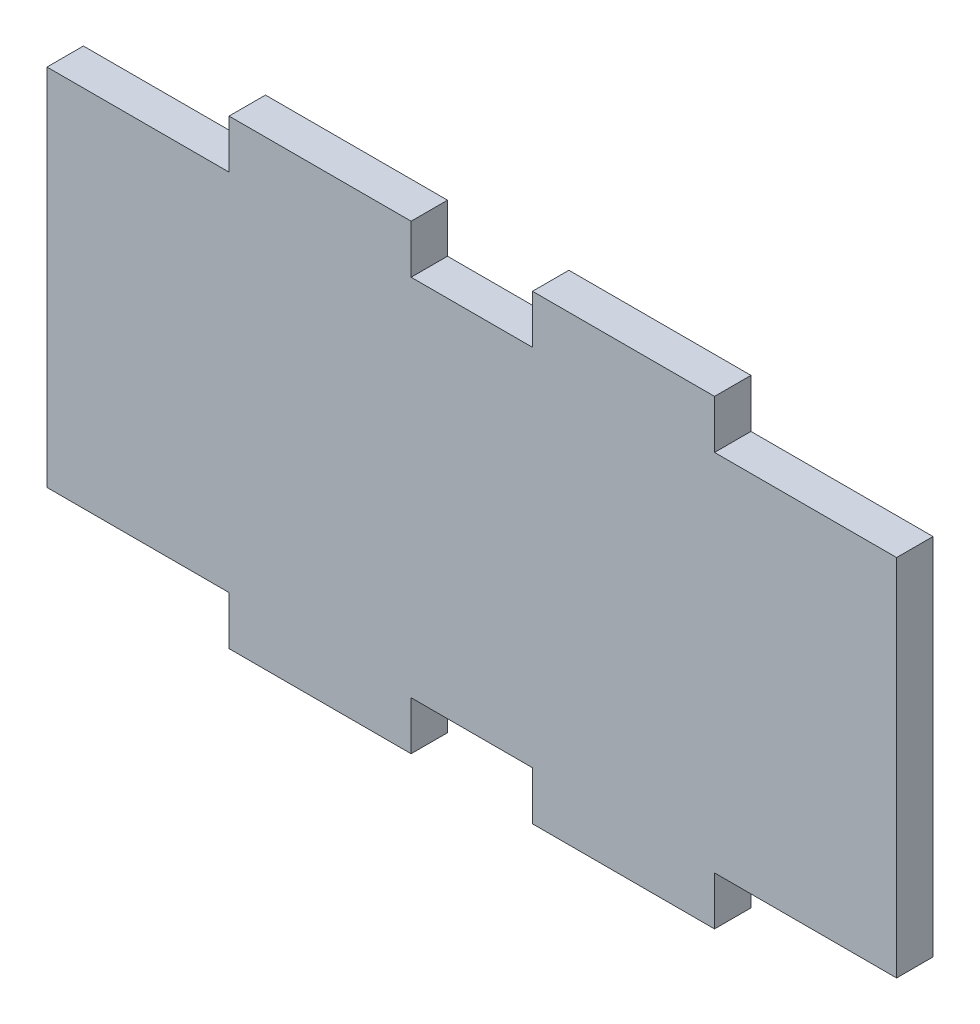
from build123d import *

# Parameters (mm, degrees)
SKETCH1_W           = 70
SKETCH1_H           = 30
BOSS_EXTRUDE1_DEPTH = 3
SKETCH2_W           = 15
SKETCH2_H           = 4
BOSS_EXTRUDE2_DEPTH = 3


with BuildPart() as part:
    # Sketch1 → Boss-Extrude1 (new body)
    with BuildSketch(Plane.XY):
        with Locations((-35, 15)):
            Rectangle(SKETCH1_W, SKETCH1_H)
    extrude(amount=BOSS_EXTRUDE1_DEPTH)

    # Sketch2 → Boss-Extrude2 (add)
    with BuildSketch(Plane.XY.offset(3)):
        with Locations((-22.5, 32)):
            Rectangle(SKETCH2_W, SKETCH2_H)
        with Locations((-47.5, 32)):
            Rectangle(SKETCH2_W, SKETCH2_H)
        with Locations((-22.5, -2)):
            Rectangle(SKETCH2_W, SKETCH2_H)
        with Locations((-47.5, -2)):
            Rectangle(SKETCH2_W, SKETCH2_H)
    extrude(amount=-BOSS_EXTRUDE2_DEPTH)


solid = part.part
